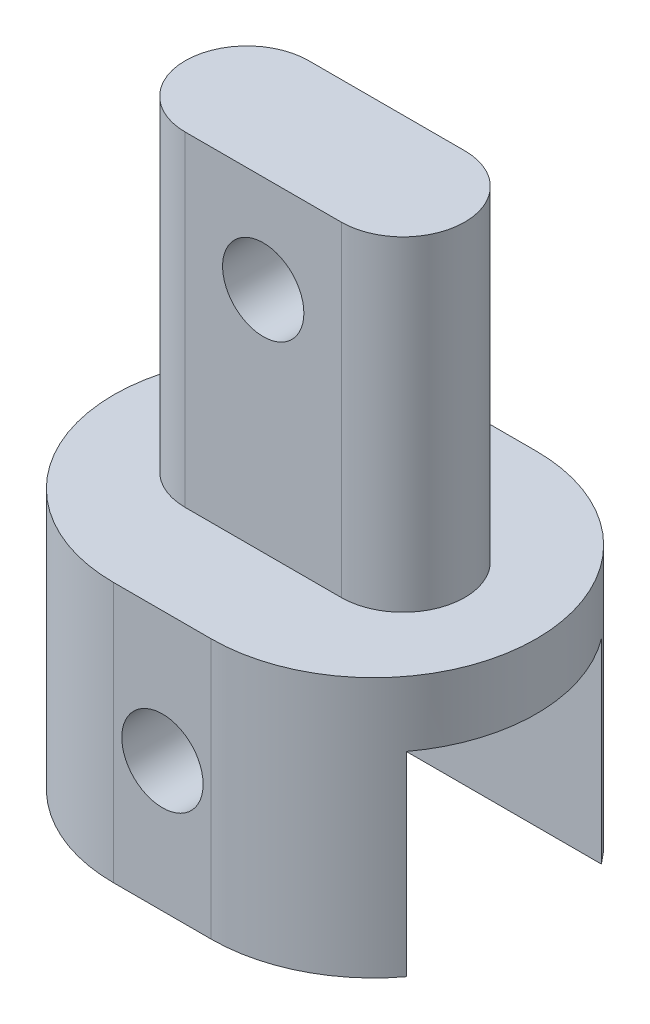
from build123d import *

# Parameters (mm, degrees)
EXTRUDE_1_DEPTH     = 8
EXTRUDE_2_DEPTH     = 10
SKETCH_3_R          = 1.25
CUT_EXTRUDE_1_DEPTH = 6
SKETCH_4_W          = 25.11911159
SKETCH_4_H          = 6
CUT_EXTRUDE_2_DEPTH = 6
SKETCH_5_R          = 1.25
CUT_EXTRUDE_3_DEPTH = 22.592822882


with BuildPart() as part:
    # 草图1 → 凸台-拉伸1 (new body)
    with BuildSketch(Plane(origin=(0, 0, 0), x_dir=(1, 0, 0), z_dir=(0, 1, 0))):
        with BuildLine():
            Line((-1.5, 5), (1.5, 5))
            ThreePointArc((1.5, 5), (6.5, 0), (1.5, -5))
            Line((1.5, -5), (-1.5, -5))
            ThreePointArc((-1.5, -5), (-6.5, 0), (-1.5, 5))
        make_face()
    extrude(amount=EXTRUDE_1_DEPTH)

    # 草图2 → 凸台-拉伸2 (add)
    with BuildSketch(Plane(origin=(0, 8, 0), x_dir=(1, 0, 0), z_dir=(0, 1, 0))):
        with BuildLine():
            Line((-2.4, 1.9), (2.4, 1.9))
            ThreePointArc((2.4, 1.9), (4.3, 0), (2.4, -1.9))
            Line((2.4, -1.9), (-2.4, -1.9))
            ThreePointArc((-2.4, -1.9), (-4.3, 0), (-2.4, 1.9))
        make_face()
    extrude(amount=EXTRUDE_2_DEPTH)

    # 草图3 → 切除-拉伸1 (cut)
    with BuildSketch(Plane.XY.offset(1.9)):
        with Locations((0, 15)):
            Circle(SKETCH_3_R)
    extrude(amount=-CUT_EXTRUDE_1_DEPTH, mode=Mode.SUBTRACT)

    # 草图4 → 切除-拉伸2 (cut)
    with BuildSketch(Plane.XZ):
        Rectangle(SKETCH_4_W, SKETCH_4_H)
    extrude(amount=-CUT_EXTRUDE_2_DEPTH, mode=Mode.SUBTRACT)

    # 草图5 → 切除-拉伸3 (cut, through all)
    with BuildSketch(Plane.XY.offset(5)):
        with Locations((0, 4)):
            Circle(SKETCH_5_R)
    extrude(amount=-CUT_EXTRUDE_3_DEPTH, mode=Mode.SUBTRACT)


solid = part.part
